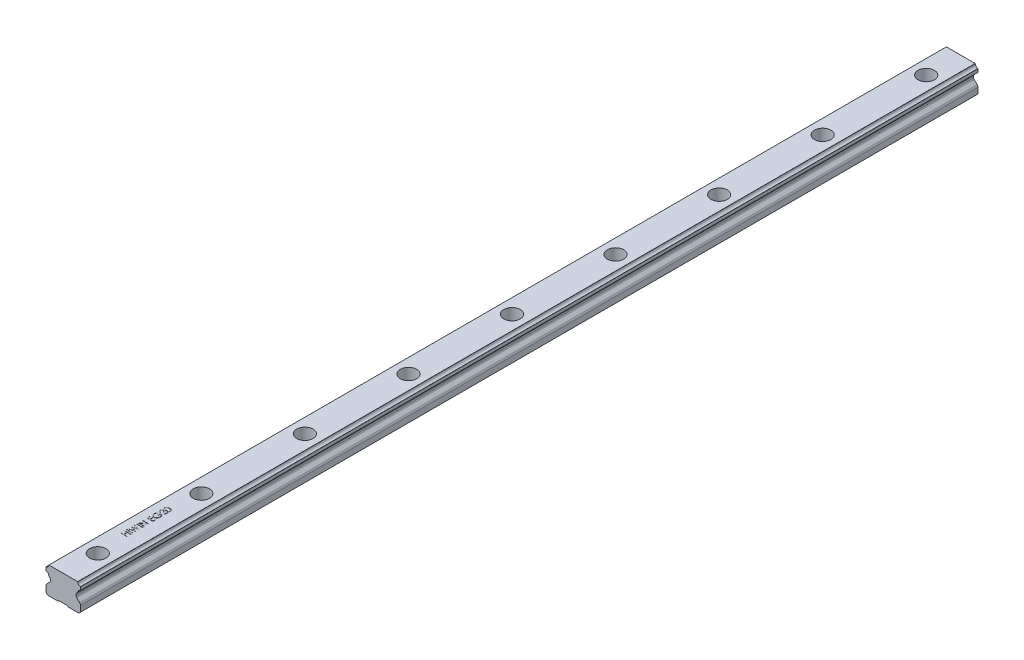
from build123d import *

# Parameters (mm, degrees)
EXTRUDE_1_DEPTH              = 520
HOLE_WIZARD_M5_1_D           = 6
HOLE_WIZARD_M5_1_CBORE_D     = 9.5
HOLE_WIZARD_M5_1_CBORE_DEPTH = 8.5
PATTERN_LINEAR_1_COUNT       = 9
PATTERN_LINEAR_1_PITCH       = 60
SKETCH_6_W                   = 3.5
SKETCH_6_H                   = 0.314102564
CUT_EXTRUDE_1_DEPTH          = 0.1


with BuildPart() as part:
    # 草图1 → 凸台-拉伸1 (new body)
    with BuildSketch(Plane.XY):
        with BuildLine():
            Line((8.389568494, 15.444645233), (8.334214323, 15.499999915))
            Line((8.334214323, 15.499999915), (-8.334214323, 15.499999915))
            Line((-8.334214323, 15.499999915), (-8.389568494, 15.444645232))
            ThreePointArc((-8.389568494, 15.444645232), (-8.870154648, 14.329940088), (-9.960346393, 13.796074404))
            ThreePointArc((-9.960346393, 13.796074404), (-9.989917398, 13.724134773), (-10.000000323, 13.647010915))
            Line((-10.000000323, 13.647010915), (-10.000000323, 11.952988915))
            ThreePointArc((-10.000000323, 11.952988915), (-9.989917398, 11.875865057), (-9.960346393, 11.803925426))
            ThreePointArc((-9.960346393, 11.803925426), (-8.870154826, 11.270059929), (-8.389568521, 10.155355114))
            Line((-8.389568521, 10.155355114), (-7.792893323, 9.558679915))
            ThreePointArc((-7.792893323, 9.558679915), (-7.576120538, 9.234256516), (-7.500000058, 8.851573025))
            Line((-7.500000058, 8.851573025), (-7.500000058, 7.914268025))
            ThreePointArc((-7.500000058, 7.914268025), (-7.576120504, 7.531584675), (-7.792893194, 7.207161389))
            Line((-7.792893194, 7.207161389), (-9.560660194, 5.439394196))
            ThreePointArc((-9.560660194, 5.439394196), (-9.885819304, 4.952759155), (-9.999999999, 4.378734))
            Line((-9.999999999, 4.378734), (-9.999999999, 1))
            Line((-9.999999999, 1), (-8.999999999, 0))
            Line((-8.999999999, 0), (-3.000000001, 0))
            Line((-3.000000001, 0), (-2.5, 0.500000001))
            Line((-2.5, 0.500000001), (2.5, 0.500000001))
            Line((2.5, 0.500000001), (3.000000002, 0))
            Line((3.000000002, 0), (9, 0))
            Line((9, 0), (10, 1))
            Line((10, 1), (10, 4.378734))
            ThreePointArc((10, 4.378734), (9.885819276, 4.95275924), (9.560660083, 5.439394334))
            Line((9.560660083, 5.439394334), (7.792893083, 7.20716121))
            ThreePointArc((7.792893083, 7.20716121), (7.576120336, 7.531584536), (7.499999869, 7.914267946))
            Line((7.499999869, 7.914267946), (7.499999869, 8.851572946))
            ThreePointArc((7.499999869, 8.851572946), (7.576120348, 9.234256438), (7.792893133, 9.558679837))
            Line((7.792893133, 9.558679837), (8.389568332, 10.155355036))
            ThreePointArc((8.389568332, 10.155355036), (8.870154637, 11.27005985), (9.960346203, 11.803925347))
            ThreePointArc((9.960346203, 11.803925347), (9.989917208, 11.875864978), (10.000000133, 11.952988837))
            Line((10.000000133, 11.952988837), (10.000000133, 13.647010837))
            ThreePointArc((10.000000133, 13.647010837), (9.989917208, 13.724134695), (9.960346204, 13.796074326))
            ThreePointArc((9.960346204, 13.796074326), (8.870154552, 14.329940097), (8.389568494, 15.444645233))
        make_face()
    extrude(amount=-EXTRUDE_1_DEPTH)

    # M5 六角凹头螺钉的柱形沉头孔1 (through all)
    with Locations(Plane(origin=(0.802971828, 15.499999915, -26.915534725), x_dir=(-1, 0, 0), z_dir=(0, 1, 0))):
        with Locations((0.802971828, 6.915534725)):
            hole_wizard_m5_1 = CounterBoreHole(HOLE_WIZARD_M5_1_D / 2, HOLE_WIZARD_M5_1_CBORE_D / 2, HOLE_WIZARD_M5_1_CBORE_DEPTH)

    # 阵列(线性)1: M5 六角凹头螺钉的柱形沉头孔1 ×9
    with Locations(*[(0, 0, -i * PATTERN_LINEAR_1_PITCH) for i in range(1, PATTERN_LINEAR_1_COUNT)]):
        add(hole_wizard_m5_1, mode=Mode.SUBTRACT)

    # 草图6 → 切除-拉伸1 (cut)
    # profile 1 of 9: a face of its own
    with BuildSketch(Plane(origin=(0, 15.499999915, 0), x_dir=(1, 0, 0), z_dir=(0, 1, 0))):
        Polygon((-3.5, 36.762820513), (-3.5, 37.076923077), (-2.064102564, 37.076923077), (-2.064102564, 38.871794872), (-3.5, 38.871794872), (-3.5, 39.185897436), (0, 39.185897436), (0, 38.871794872), (-1.705128205, 38.871794872), (-1.705128205, 37.076923077), (0, 37.076923077), (0, 36.762820513), align=None)
    # profile 2 of 9: a face of its own
    with BuildSketch(Plane(origin=(0, 15.499999915, 0), x_dir=(1, 0, 0), z_dir=(0, 1, 0))):
        with Locations((-1.75, 40.240384615)):
            Rectangle(SKETCH_6_W, SKETCH_6_H)
    # profile 3 of 9: a face of its own
    with BuildSketch(Plane(origin=(0, 15.499999915, 0), x_dir=(1, 0, 0), z_dir=(0, 1, 0))):
        Polygon((-3.5, 40.935897436), (-3.5, 41.260516827), (-0.933193109, 41.945512821), (-3.5, 42.964242788), (-3.5, 43.009815705), (-0.950721154, 44.009615385), (-3.5, 44.698116987), (-3.5, 45.019230769), (0, 44.075520833), (0, 44.030649038), (-2.676883013, 42.977564103), (0, 41.911858974), (0, 41.866987179), align=None)
    # profile 4 of 9: a face of its own
    with BuildSketch(Plane(origin=(0, 15.499999915, 0), x_dir=(1, 0, 0), z_dir=(0, 1, 0))):
        with Locations((-1.75, 45.983974359)):
            Rectangle(SKETCH_6_W, SKETCH_6_H)
    # profile 5 of 9: a face of its own
    with BuildSketch(Plane(origin=(0, 15.499999915, 0), x_dir=(1, 0, 0), z_dir=(0, 1, 0))):
        Polygon((0, 46.903846154), (-3.5, 46.903846154), (-3.5, 46.969751603), (-0.745292468, 49.282051282), (-3.5, 49.282051282), (-3.5, 49.596153846), (0, 49.596153846), (0, 49.524639423), (-2.748397436, 47.217948718), (0, 47.217948718), align=None)
    # profile 6 of 9: a face of its own
    with BuildSketch(Plane(origin=(0, 15.499999915, 0), x_dir=(1, 0, 0), z_dir=(0, 1, 0))):
        Polygon((-3.5, 51.83974359), (-3.5, 53.814102564), (-3.141025641, 53.814102564), (-3.141025641, 52.153846154), (-2.064102564, 52.153846154), (-2.064102564, 53.814102564), (-1.705128205, 53.814102564), (-1.705128205, 52.153846154), (-0.358974359, 52.153846154), (-0.358974359, 53.814102564), (0, 53.814102564), (0, 51.83974359), align=None)
    # profile 7 of 9: a face of its own
    with BuildSketch(Plane(origin=(0, 15.499999915, 0), x_dir=(1, 0, 0), z_dir=(0, 1, 0))):
        with BuildLine():
            Line((-2.902644231, 57.717948718), (-2.647435897, 57.448717949))
            add(Edge.make_bspline(
                [(-2.647435897, 57.448717949), (-2.69328212, 57.400008868), (-2.783881335, 57.303752203), (-2.901244074, 57.146552261), (-3.002777003, 56.983196408), (-3.084772592, 56.813420508), (-3.149094254, 56.641676508), (-3.195850217, 56.470917554), (-3.225460377, 56.302249256), (-3.229016796, 56.190084954), (-3.230769231, 56.134815705)],
                knots=[0, 0, 0, 0, 1.089067066, 2.152164705, 3.18986567, 4.218445106, 5.218487318, 6.173592265, 7.100032889, 8, 8, 8, 8], degree=3))
            add(Edge.make_bspline(
                [(-3.230769231, 56.134815705), (-3.230355625, 56.100901005), (-3.229529486, 56.033159565), (-3.218985271, 55.932537621), (-3.203820407, 55.832970983), (-3.181878529, 55.734647609), (-3.15406947, 55.637376321), (-3.119284004, 55.541495434), (-3.078728771, 55.446826062), (-3.031866252, 55.354260043), (-2.980386575, 55.26451931), (-2.923337414, 55.179763314), (-2.862550889, 55.099446852), (-2.796491613, 55.025097645), (-2.725807311, 54.956221131), (-2.651770944, 54.89155043), (-2.572926872, 54.832290852), (-2.489599321, 54.779505212), (-2.403726867, 54.731837618), (-2.316037795, 54.690645418), (-2.227346143, 54.654835464), (-2.136984078, 54.627561503), (-2.045883197, 54.604460629), (-1.953566086, 54.588379393), (-1.859791669, 54.579283076), (-1.796993971, 54.577712585), (-1.765424679, 54.576923077)],
                knots=[0, 0, 0, 0, 1.028150113, 2.053633673, 3.06513288, 4.081487945, 5.106702018, 6.131327874, 7.172780699, 8.228344599, 9.276313556, 10.308389736, 11.324843658, 12.329040066, 13.321460474, 14.316307835, 15.308626991, 16.309440696, 17.305625405, 18.28535951, 19.246194545, 20.203493668, 21.145557131, 22.095268976, 23.042464743, 24, 24, 24, 24], degree=3))
            add(Edge.make_bspline(
                [(-1.765424679, 54.576923077), (-1.733154018, 54.577679272), (-1.668700816, 54.579189598), (-1.572504414, 54.588842795), (-1.477747832, 54.606798005), (-1.384282029, 54.630609755), (-1.291920993, 54.66088243), (-1.20076111, 54.698074944), (-1.110811241, 54.742381076), (-1.022964324, 54.793552345), (-0.937464192, 54.850061813), (-0.856251713, 54.912212997), (-0.780271995, 54.980110534), (-0.708415252, 55.052509477), (-0.641134974, 55.130069473), (-0.579242122, 55.213543005), (-0.521779643, 55.301761597), (-0.469378807, 55.394764386), (-0.42257144, 55.491568366), (-0.38094723, 55.590824797), (-0.346667976, 55.692852699), (-0.31872985, 55.797115365), (-0.295829559, 55.903488643), (-0.281097077, 56.012512444), (-0.270406246, 56.123385153), (-0.269624576, 56.198123785), (-0.269230769, 56.235777244)],
                knots=[0, 0, 0, 0, 0.935915162, 1.869274651, 2.799799983, 3.730201895, 4.664668062, 5.616159355, 6.583070886, 7.570012957, 8.562524459, 9.553461134, 10.53281078, 11.515274572, 12.509912756, 13.507571325, 14.526460018, 15.561318395, 16.601025881, 17.643204557, 18.680545676, 19.719612342, 20.772381578, 21.833430283, 22.908478249, 24, 24, 24, 24], degree=3))
            add(Edge.make_bspline(
                [(-0.269230769, 56.235777244), (-0.270178952, 56.281155776), (-0.272040863, 56.370263896), (-0.286546735, 56.501247716), (-0.309173205, 56.627060334), (-0.342412256, 56.747292172), (-0.384484705, 56.862379567), (-0.436513285, 56.971898055), (-0.497950569, 57.076150049), (-0.567552463, 57.174684309), (-0.645100929, 57.26515833), (-0.728035637, 57.347500409), (-0.817431068, 57.418879031), (-0.911954918, 57.481426348), (-1.012511326, 57.533123592), (-1.118540888, 57.57556947), (-1.230109213, 57.608101926), (-1.307200733, 57.621457015), (-1.346153846, 57.628205128)],
                knots=[0, 0, 0, 0, 1.130199668, 2.219330667, 3.279027493, 4.311506524, 5.322739849, 6.327972234, 7.327472899, 8.33386792, 9.329086447, 10.29244429, 11.240784345, 12.174119183, 13.111530729, 14.052100829, 15.015757696, 16, 16, 16, 16], degree=3))
            Line((-1.346153846, 57.628205128), (-1.346153846, 56.461538462))
            Line((-1.346153846, 56.461538462), (-1.705128205, 56.461538462))
            Line((-1.705128205, 56.461538462), (-1.705128205, 57.942307692))
            add(Edge.make_bspline(
                [(-1.705128205, 57.942307692), (-1.638220716, 57.940601844), (-1.507270675, 57.937263191), (-1.316300404, 57.913844275), (-1.13592871, 57.876027763), (-0.965965639, 57.824367451), (-0.806652046, 57.75749217), (-0.65782618, 57.676119642), (-0.520449499, 57.578947521), (-0.393400495, 57.469437079), (-0.280071283, 57.346537122), (-0.180465345, 57.213568502), (-0.09656273, 57.070311533), (-0.028302067, 56.916901726), (0.024971927, 56.753841292), (0.062743504, 56.580752913), (0.085373467, 56.397871312), (0.088264847, 56.272534635), (0.08974359, 56.208433494)],
                knots=[0, 0, 0, 0, 1.140356446, 2.231883559, 3.274166699, 4.278491846, 5.25512956, 6.21435461, 7.1637429, 8.11826594, 9.068280886, 10.0076534, 10.945064095, 11.891975133, 12.864533718, 13.863980011, 14.907571808, 16, 16, 16, 16], degree=3))
            add(Edge.make_bspline(
                [(0.08974359, 56.208433494), (0.089174469, 56.168923358), (0.088051978, 56.090996637), (0.080074631, 55.975905709), (0.067794054, 55.863988089), (0.049248931, 55.75526008), (0.026534277, 55.649321738), (-0.002552442, 55.546702153), (-0.036221141, 55.447010411), (-0.074516815, 55.350092425), (-0.118888472, 55.256827878), (-0.168198111, 55.166801361), (-0.222191472, 55.079515236), (-0.281802318, 54.995564071), (-0.346584778, 54.914510449), (-0.416668697, 54.836877005), (-0.491839816, 54.762229127), (-0.545218826, 54.715468664), (-0.572115385, 54.691907051)],
                knots=[0, 0, 0, 0, 1.107784379, 2.184907829, 3.233506516, 4.263428166, 5.276301166, 6.270063455, 7.25232949, 8.225834625, 9.190232166, 10.146266622, 11.1027726, 12.066435141, 13.031522626, 14.010570082, 14.99756817, 16, 16, 16, 16], degree=3))
            add(Edge.make_bspline(
                [(-0.572115385, 54.691907051), (-0.614786038, 54.657721119), (-0.699419055, 54.589916707), (-0.835018999, 54.50263855), (-0.975420859, 54.428237147), (-1.121015488, 54.367869325), (-1.271666701, 54.320731239), (-1.427181992, 54.286924986), (-1.587761622, 54.267117697), (-1.696426887, 54.264264159), (-1.751402244, 54.262820513)],
                knots=[0, 0, 0, 0, 1.023165419, 2.029347347, 3.013907458, 3.994755782, 4.975994455, 5.96558838, 6.970761222, 8, 8, 8, 8], degree=3))
            add(Edge.make_bspline(
                [(-1.751402244, 54.262820513), (-1.792568496, 54.263352751), (-1.874377804, 54.264410462), (-1.99583511, 54.27723598), (-2.115135808, 54.295637392), (-2.232182344, 54.322684468), (-2.347053012, 54.356780654), (-2.45980069, 54.399334435), (-2.570493643, 54.448878213), (-2.67836343, 54.50646793), (-2.782003044, 54.570536667), (-2.880905313, 54.640144323), (-2.973467332, 54.715828008), (-3.059903521, 54.797808103), (-3.141494975, 54.884432033), (-3.216537375, 54.977518334), (-3.286205011, 55.07565667), (-3.349159221, 55.17960781), (-3.405727075, 55.287731441), (-3.455315154, 55.399792527), (-3.496298775, 55.515750345), (-3.531072472, 55.634737902), (-3.556787635, 55.757655381), (-3.575436374, 55.883610924), (-3.588196976, 56.013261034), (-3.589223231, 56.100897064), (-3.58974359, 56.145332532)],
                knots=[0, 0, 0, 0, 1.00895651, 2.005089799, 2.991467152, 3.967318338, 4.948153826, 5.927364234, 6.919980553, 7.91976625, 8.923240147, 9.905815003, 10.88314567, 11.851989312, 12.825009789, 13.798721852, 14.781296708, 15.773896486, 16.776076962, 17.771600213, 18.775744723, 19.78957137, 20.808953803, 21.851964491, 22.910847925, 24, 24, 24, 24], degree=3))
            add(Edge.make_bspline(
                [(-3.58974359, 56.145332532), (-3.589164098, 56.181570776), (-3.588015034, 56.253426954), (-3.580050386, 56.360352687), (-3.567426505, 56.465625701), (-3.550199718, 56.569402091), (-3.526736028, 56.671328458), (-3.498657743, 56.771695163), (-3.46596592, 56.870647699), (-3.426977074, 56.967875948), (-3.382723449, 57.064033664), (-3.332910027, 57.159655505), (-3.276685022, 57.254414751), (-3.213881487, 57.348475732), (-3.145578069, 57.44243159), (-3.069821245, 57.534796233), (-2.989598489, 57.627799177), (-2.931916305, 57.687600991), (-2.902644231, 57.717948718)],
                knots=[0, 0, 0, 0, 0.985871117, 1.954866573, 2.915460327, 3.869826059, 4.81536089, 5.759505086, 6.70452669, 7.649098992, 8.607881297, 9.583363685, 10.581137262, 11.603961102, 12.659522466, 13.73993555, 14.853081303, 16, 16, 16, 16], degree=3))
        make_face()
    # profile 8 of 9: a face of its own
    with BuildSketch(Plane(origin=(0, 15.499999915, 0), x_dir=(1, 0, 0), z_dir=(0, 1, 0))):
        with BuildLine():
            Line((-2.423076923, 58.794871795), (-2.423076923, 58.480769231))
            add(Edge.make_bspline(
                [(-2.423076923, 58.480769231), (-2.464747811, 58.482816384), (-2.546588325, 58.486836938), (-2.665912232, 58.505665227), (-2.779967031, 58.532606104), (-2.887836945, 58.570697558), (-2.990475752, 58.618003836), (-3.087475767, 58.674733863), (-3.178466956, 58.741927714), (-3.262605799, 58.818134448), (-3.33979337, 58.900903087), (-3.406448613, 58.990209027), (-3.462766284, 59.084054054), (-3.509847526, 59.182153453), (-3.545187372, 59.285614016), (-3.571409012, 59.393496874), (-3.587185357, 59.506276011), (-3.588881143, 59.583116033), (-3.58974359, 59.622195513)],
                knots=[0, 0, 0, 0, 1.10065271, 2.161652631, 3.183658789, 4.190468796, 5.17591951, 6.163126047, 7.15150782, 8.156236427, 9.156009102, 10.134482811, 11.092018607, 12.041330605, 13.001268258, 13.972401359, 14.968799086, 16, 16, 16, 16], degree=3))
            add(Edge.make_bspline(
                [(-3.58974359, 59.622195513), (-3.588852424, 59.660576288), (-3.587101316, 59.735993139), (-3.571837144, 59.846016947), (-3.54844616, 59.951006046), (-3.513784407, 60.049770596), (-3.47029149, 60.1433242), (-3.416202348, 60.230508508), (-3.354076299, 60.313431728), (-3.280795578, 60.388024133), (-3.202604863, 60.456546255), (-3.119097837, 60.515608182), (-3.032749001, 60.566472778), (-2.942883845, 60.608103861), (-2.849209723, 60.639662073), (-2.752624723, 60.663043684), (-2.652014188, 60.676409876), (-2.583905673, 60.678449978), (-2.549278846, 60.679487179)],
                knots=[0, 0, 0, 0, 1.111674182, 2.184400057, 3.212814286, 4.223731311, 5.211378316, 6.196328225, 7.191884489, 8.207283132, 9.220262353, 10.201199469, 11.166417575, 12.120932471, 13.06540007, 14.026332106, 14.996573967, 16, 16, 16, 16], degree=3))
            add(Edge.make_bspline(
                [(-2.549278846, 60.679487179), (-2.500531033, 60.67779389), (-2.403890861, 60.674437026), (-2.26187569, 60.645723039), (-2.124283442, 60.600875044), (-2.013542366, 60.546882472), (-1.924317319, 60.492399318), (-1.850817554, 60.443351191), (-1.771698892, 60.3856057), (-1.686641103, 60.319656196), (-1.59675809, 60.244366935), (-1.500215998, 60.161693923), (-1.398799957, 60.0695021), (-1.329486308, 60.004853468), (-1.293569712, 59.971354167)],
                knots=[0, 0, 0, 0, 1.184416499, 2.348048165, 3.509039915, 4.696071444, 5.333504901, 6.05069495, 6.844171097, 7.714965912, 8.667477798, 9.695072654, 10.805644396, 12, 12, 12, 12], degree=3))
            Line((-1.293569712, 59.971354167), (-0.358974359, 59.095653045))
            Line((-0.358974359, 59.095653045), (-0.358974359, 60.724358974))
            Line((-0.358974359, 60.724358974), (0, 60.724358974))
            Line((0, 60.724358974), (0, 58.346153846))
            Line((0, 58.346153846), (-1.448517628, 59.703525641))
            add(Edge.make_bspline(
                [(-1.448517628, 59.703525641), (-1.483015935, 59.736573528), (-1.549280121, 59.800051755), (-1.646023081, 59.889834332), (-1.735772622, 59.97047332), (-1.818359171, 60.042490713), (-1.894990738, 60.104324218), (-1.963185442, 60.15919645), (-2.025939892, 60.203162041), (-2.098680506, 60.250877437), (-2.187492823, 60.297091418), (-2.296026513, 60.336803774), (-2.407753765, 60.361018623), (-2.483255802, 60.363923458), (-2.521233974, 60.365384615)],
                knots=[0, 0, 0, 0, 1.329631726, 2.553950428, 3.673215718, 4.687767853, 5.603093632, 6.413772471, 7.123043292, 7.734684054, 8.834405432, 9.900288307, 10.943827018, 12, 12, 12, 12], degree=3))
            add(Edge.make_bspline(
                [(-2.521233974, 60.365384615), (-2.545115373, 60.364748873), (-2.592181023, 60.363495947), (-2.661186782, 60.35243825), (-2.727751596, 60.335727744), (-2.792080215, 60.311782485), (-2.853525867, 60.280175745), (-2.912163347, 60.241702365), (-2.968852313, 60.197312302), (-3.022005611, 60.145961033), (-3.070686816, 60.089549513), (-3.113810902, 60.029955263), (-3.149850012, 59.966905159), (-3.179393509, 59.900665037), (-3.202568891, 59.831419567), (-3.21862747, 59.759034822), (-3.228709954, 59.683710806), (-3.230074126, 59.63227731), (-3.230769231, 59.606069712)],
                knots=[0, 0, 0, 0, 0.991446411, 1.95395049, 2.89581595, 3.838931463, 4.798493298, 5.75982156, 6.748411868, 7.785213223, 8.824556874, 9.840280684, 10.836137867, 11.835679398, 12.848801643, 13.863922112, 14.911575587, 16, 16, 16, 16], degree=3))
            add(Edge.make_bspline(
                [(-3.230769231, 59.606069712), (-3.230082413, 59.578692009), (-3.228733615, 59.524926721), (-3.218517149, 59.446154931), (-3.203028983, 59.370491191), (-3.178430394, 59.299064471), (-3.149365939, 59.230328072), (-3.11244268, 59.165749406), (-3.069537034, 59.104256271), (-3.019786187, 59.046860109), (-2.963887514, 58.994439145), (-2.902283318, 58.947732824), (-2.835417099, 58.907191743), (-2.76356329, 58.871770625), (-2.686006495, 58.843018271), (-2.603039645, 58.821044175), (-2.515018024, 58.803657593), (-2.454232973, 58.797849035), (-2.423076923, 58.794871795)],
                knots=[0, 0, 0, 0, 1.030878251, 2.024474673, 2.987898669, 3.934362936, 4.864849709, 5.795128259, 6.730474222, 7.685293701, 8.650606017, 9.611896181, 10.591709709, 11.591680886, 12.625074257, 13.701333388, 14.821793024, 16, 16, 16, 16], degree=3))
        make_face()
    # profile 9 of 9: a face of its own
    with BuildSketch(Plane(origin=(0, 15.499999915, 0), x_dir=(1, 0, 0), z_dir=(0, 1, 0))):
        with BuildLine():
            add(Edge.make_bspline(
                [(-1.748597756, 61.038461538), (-1.804695144, 61.038789557), (-1.913665128, 61.039426737), (-2.07244977, 61.046515158), (-2.22141006, 61.0582905), (-2.360553125, 61.074427873), (-2.489914892, 61.094065851), (-2.609149641, 61.120281345), (-2.718809275, 61.150094123), (-2.819251231, 61.184646654), (-2.911829251, 61.223634148), (-2.998253337, 61.266069447), (-3.078399222, 61.31363056), (-3.153522881, 61.363620634), (-3.222476964, 61.417985777), (-3.286055953, 61.475560296), (-3.343723673, 61.537495691), (-3.395519616, 61.603191243), (-3.4409371, 61.672201705), (-3.481188747, 61.742641277), (-3.514343815, 61.81576856), (-3.541465573, 61.890620872), (-3.56360569, 61.967355975), (-3.578813682, 62.045954279), (-3.588365511, 62.12659798), (-3.589279872, 62.181029096), (-3.58974359, 62.208633814)],
                knots=[0, 0, 0, 0, 1.646148282, 3.197666765, 4.66315463, 6.030252048, 7.307778049, 8.501004361, 9.610818041, 10.641065266, 11.615491391, 12.557119604, 13.464013759, 14.348536654, 15.203310953, 16.038349431, 16.863300206, 17.683791446, 18.490318933, 19.285717724, 20.06220424, 20.843281102, 21.620494212, 22.403315558, 23.190242141, 24, 24, 24, 24], degree=3))
            add(Edge.make_bspline(
                [(-3.58974359, 62.208633814), (-3.58935734, 62.236482792), (-3.588588839, 62.291892456), (-3.57777172, 62.373517604), (-3.563809751, 62.453720982), (-3.541417054, 62.531285744), (-3.514621286, 62.607678494), (-3.479264697, 62.680999494), (-3.440811661, 62.753837366), (-3.393902192, 62.822883181), (-3.342059509, 62.890199903), (-3.283204809, 62.953302301), (-3.218966904, 63.013803442), (-3.1479131, 63.069418221), (-3.071132863, 63.12253021), (-2.987982553, 63.171123224), (-2.898646443, 63.21620791), (-2.803538681, 63.25863174), (-2.700118793, 63.295730259), (-2.589031834, 63.328713808), (-2.46927186, 63.355749407), (-2.341506009, 63.378107373), (-2.20510133, 63.39546141), (-2.060334196, 63.408091385), (-1.907114038, 63.414765228), (-1.802356156, 63.416021823), (-1.748597756, 63.416666667)],
                knots=[0, 0, 0, 0, 0.810910589, 1.61342667, 2.396193133, 3.181089899, 3.963115317, 4.752255436, 5.550715454, 6.36105385, 7.181178335, 8.024612154, 8.872680183, 9.750181803, 10.651284446, 11.591556747, 12.554036451, 13.566402641, 14.62422919, 15.753422176, 16.94128843, 18.199818041, 19.531985927, 20.947085226, 22.433341622, 24, 24, 24, 24], degree=3))
            add(Edge.make_bspline(
                [(-1.748597756, 63.416666667), (-1.695074317, 63.416007636), (-1.590552634, 63.414720666), (-1.438014706, 63.40823452), (-1.294027899, 63.395152918), (-1.1584387, 63.379028197), (-1.031184245, 63.356420339), (-0.912347453, 63.329179739), (-0.801507589, 63.298143127), (-0.699458804, 63.260475246), (-0.604516084, 63.219038865), (-0.515836856, 63.174002558), (-0.432708505, 63.125683762), (-0.355725748, 63.073368329), (-0.284957142, 63.016838744), (-0.220498913, 62.956380009), (-0.161269873, 62.892726653), (-0.108856037, 62.825017487), (-0.061589422, 62.755328552), (-0.021740947, 62.68248328), (0.012785419, 62.608345979), (0.041013907, 62.532176457), (0.06290543, 62.454092315), (0.07795466, 62.373833966), (0.088533112, 62.291880937), (0.0893387, 62.236478939), (0.08974359, 62.208633814)],
                knots=[0, 0, 0, 0, 1.561645053, 3.049612875, 4.452756685, 5.778837748, 7.032101753, 8.221335837, 9.334924186, 10.387562255, 11.392109817, 12.355697819, 13.287721948, 14.19548756, 15.068665045, 15.927346723, 16.771751757, 17.602390507, 18.423119567, 19.225778204, 20.022010933, 20.807278863, 21.593079439, 22.384715467, 23.188155646, 24, 24, 24, 24], degree=3))
            add(Edge.make_bspline(
                [(0.08974359, 62.208633814), (0.089277234, 62.1810297), (0.088357672, 62.126599775), (0.078843941, 62.04594735), (0.063548437, 61.967664907), (0.042131835, 61.89136615), (0.015916991, 61.816659647), (-0.018236662, 61.744563315), (-0.057570846, 61.674275802), (-0.10236583, 61.605983597), (-0.153689187, 61.540973915), (-0.210447097, 61.478865865), (-0.274095026, 61.421277148), (-0.343630904, 61.3673834), (-0.418866334, 61.316864841), (-0.499851805, 61.269714719), (-0.586725603, 61.22638952), (-0.680035274, 61.186735931), (-0.781190123, 61.151578599), (-0.891129288, 61.120643581), (-1.010969427, 61.095936731), (-1.140102086, 61.074993857), (-1.278789653, 61.058212058), (-1.427082304, 61.046520047), (-1.584698442, 61.039432118), (-1.692967691, 61.038790969), (-1.748597756, 61.038461538)],
                knots=[0, 0, 0, 0, 0.810927267, 1.598990287, 2.382942141, 3.152806972, 3.926217614, 4.706701772, 5.493896336, 6.292070767, 7.104102563, 7.925577746, 8.761822141, 9.623241997, 10.509042271, 11.423174113, 12.375371989, 13.360203808, 14.400680605, 15.520553799, 16.714061498, 17.994519714, 19.364400916, 20.818312473, 22.365209998, 24, 24, 24, 24], degree=3))
        make_face()
        with BuildLine():
            add(Edge.make_bspline(
                [(-1.75, 61.352564103), (-1.703251488, 61.352686169), (-1.612521806, 61.352923075), (-1.480908982, 61.358932983), (-1.357947449, 61.367298161), (-1.243685198, 61.377822037), (-1.138521571, 61.393583038), (-1.042019366, 61.411464856), (-0.954357206, 61.432913007), (-0.874769028, 61.45841515), (-0.802127831, 61.487464572), (-0.73449747, 61.519125749), (-0.6710764, 61.553440253), (-0.612018488, 61.591111456), (-0.558045653, 61.632884146), (-0.507789808, 61.676821734), (-0.462998805, 61.724903585), (-0.409270042, 61.79140437), (-0.353751809, 61.879202241), (-0.305405447, 61.989822275), (-0.275023059, 62.103490831), (-0.271159294, 62.180642067), (-0.269230769, 62.219150641)],
                knots=[0, 0, 0, 0, 1.459098681, 2.831824031, 4.11146945, 5.306290378, 6.412266529, 7.42953815, 8.369053297, 9.227277979, 10.03601793, 10.809473603, 11.557037441, 12.285528272, 12.993193355, 13.685654407, 14.36688038, 15.041354379, 16.352855396, 17.594313975, 18.799247529, 20, 20, 20, 20], degree=3))
            add(Edge.make_bspline(
                [(-0.269230769, 62.219150641), (-0.270919423, 62.257882126), (-0.274290741, 62.335207707), (-0.303714275, 62.448771848), (-0.351547596, 62.558108334), (-0.406196032, 62.64439553), (-0.458572725, 62.709859129), (-0.503177405, 62.756780024), (-0.553136043, 62.799840987), (-0.607034569, 62.840683364), (-0.665907268, 62.878142355), (-0.729469782, 62.912205517), (-0.797898977, 62.943288858), (-0.845668714, 62.960997905), (-0.870092147, 62.970052083)],
                knots=[0, 0, 0, 0, 1.353621445, 2.702441307, 4.075953605, 5.516772412, 6.261413105, 7.007624062, 7.778524365, 8.566925914, 9.372323995, 10.217594641, 11.088702136, 12, 12, 12, 12], degree=3))
            add(Edge.make_bspline(
                [(-0.870092147, 62.970052083), (-0.901321887, 62.980603851), (-0.964731651, 63.002028465), (-1.063095303, 63.029640239), (-1.166298067, 63.051385638), (-1.273723184, 63.070949004), (-1.386162885, 63.08430206), (-1.503269269, 63.095049873), (-1.625130631, 63.10138056), (-1.707925622, 63.102165311), (-1.75, 63.102564103)],
                knots=[0, 0, 0, 0, 0.884706709, 1.796334032, 2.740027952, 3.714592787, 4.726048262, 5.777819803, 6.87074269, 8, 8, 8, 8], degree=3))
            add(Edge.make_bspline(
                [(-1.75, 63.102564103), (-1.792067573, 63.102013913), (-1.874360737, 63.100937626), (-1.994878918, 63.096823638), (-2.109346679, 63.086200064), (-2.218257151, 63.074400944), (-2.321007456, 63.057003725), (-2.418457753, 63.03824591), (-2.509400806, 63.013044726), (-2.59526029, 62.986124855), (-2.675061285, 62.955314791), (-2.749173893, 62.921397912), (-2.817962738, 62.885180157), (-2.88121528, 62.845823923), (-2.939298414, 62.803877404), (-2.990875649, 62.757836632), (-3.038455934, 62.710625539), (-3.091796946, 62.643481412), (-3.146613642, 62.55629272), (-3.19568703, 62.447052163), (-3.224729986, 62.333992895), (-3.228757601, 62.257403791), (-3.230769231, 62.219150641)],
                knots=[0, 0, 0, 0, 1.313483664, 2.569454835, 3.763100662, 4.901599063, 5.988328865, 7.015709358, 7.99797933, 8.932480776, 9.824041341, 10.666387587, 11.475829342, 12.24921787, 12.990555181, 13.709176526, 14.405678811, 15.080244297, 16.38186033, 17.610124501, 18.806354173, 20, 20, 20, 20], degree=3))
            add(Edge.make_bspline(
                [(-3.230769231, 62.219150641), (-3.228752596, 62.180434169), (-3.224715652, 62.102930691), (-3.195821345, 61.988664056), (-3.146757221, 61.878685513), (-3.091902557, 61.791209305), (-3.038660449, 61.724880866), (-2.993345284, 61.677812651), (-2.944289777, 61.633265708), (-2.889838141, 61.592574718), (-2.830988321, 61.555126894), (-2.768387395, 61.519486257), (-2.700630668, 61.488248474), (-2.628046431, 61.459105789), (-2.548453875, 61.433561109), (-2.460474524, 61.412358028), (-2.363741864, 61.39305513), (-2.257809852, 61.379153897), (-2.143523214, 61.366912938), (-2.020247228, 61.359024818), (-1.888182457, 61.352895544), (-1.796983355, 61.352676796), (-1.75, 61.352564103)],
                knots=[0, 0, 0, 0, 1.207546505, 2.417292871, 3.651582144, 4.952510111, 5.626719005, 6.30238548, 6.989136872, 7.692112372, 8.420316868, 9.164734959, 9.937886623, 10.746308695, 11.604196049, 12.543341915, 13.568754172, 14.680483261, 15.875568977, 17.154711427, 18.534182925, 20, 20, 20, 20], degree=3))
        make_face(mode=Mode.SUBTRACT)
    extrude(amount=-CUT_EXTRUDE_1_DEPTH, mode=Mode.SUBTRACT)


solid = part.part
